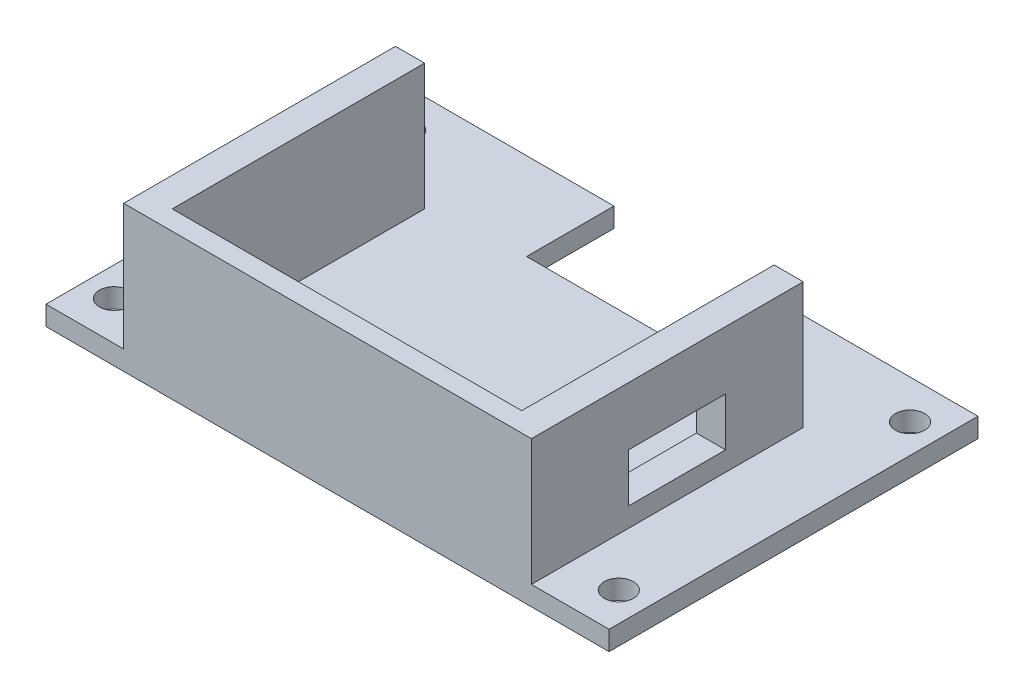
from build123d import *

# Parameters (mm, degrees)
SKETCH1_W               = 58
SKETCH1_H               = 38
BOSS_EXTRUDE1_DEPTH     = 1
CUT_EXTRUDE1_DEPTH      = 35.684290392
CUT_EXTRUDE1_DEPTH_BACK = 35.684290392
SKETCH2_W               = 17
SKETCH2_H               = 14.502040096
SKETCH3_W               = 3
SKETCH3_H               = 27
BOSS_EXTRUDE2_DEPTH     = 13
SKETCH4_W               = 42
SKETCH4_H               = 2
BOSS_EXTRUDE3_DEPTH     = 13
CUT_EXTRUDE2_START      = -42
SKETCH5_W               = 10
SKETCH5_H               = 5
CUT_EXTRUDE2_DEPTH      = 3
CUT_EXTRUDE3_REACH      = 39.027
SKETCH6_R               = 1.5


with BuildPart() as part:
    # Sketch1 → Boss-Extrude1 (new, symmetric)
    with BuildSketch(Plane(origin=(0, 0, 0), x_dir=(1, 0, 0), z_dir=(0, 1, 0))):
        Rectangle(SKETCH1_W, SKETCH1_H)
    extrude(amount=BOSS_EXTRUDE1_DEPTH, both=True)

    # Sketch2 → Cut-Extrude1 (cut, two sides: drawn at the far end of the back side and taken through both)
    with BuildSketch(Plane(origin=(0, 0, 0), x_dir=(1, 0, 0), z_dir=(0, 1, 0)).offset(-CUT_EXTRUDE1_DEPTH_BACK)):
        with Locations((0, 17.251020048)):
            Rectangle(SKETCH2_W, SKETCH2_H)
    extrude(amount=CUT_EXTRUDE1_DEPTH + CUT_EXTRUDE1_DEPTH_BACK, mode=Mode.SUBTRACT)

    # Sketch3 → Boss-Extrude2 (add)
    with BuildSketch(Plane(origin=(0, 1, 0), x_dir=(1, 0, 0), z_dir=(0, 1, 0))):
        with Locations((19.5, -4.5)):
            Rectangle(SKETCH3_W, SKETCH3_H)
        with Locations((-19.5, -4.5)):
            Rectangle(SKETCH3_W, SKETCH3_H)
    extrude(amount=BOSS_EXTRUDE2_DEPTH)

    # Sketch4 → Boss-Extrude3 (add)
    with BuildSketch(Plane(origin=(0, 1, 0), x_dir=(1, 0, 0), z_dir=(0, 1, 0))):
        with Locations((0, -18)):
            Rectangle(SKETCH4_W, SKETCH4_H)
    extrude(amount=BOSS_EXTRUDE3_DEPTH)

    # Sketch5 → Cut-Extrude2 (cut)
    with BuildSketch(Plane.ZY.offset(21).offset(CUT_EXTRUDE2_START)):
        with Locations((4, 5.5)):
            Rectangle(SKETCH5_W, SKETCH5_H)
    extrude(amount=CUT_EXTRUDE2_DEPTH, mode=Mode.SUBTRACT)

    # Sketch6 → Cut-Extrude3 (cut, up to next)
    with BuildSketch(Plane(origin=(0, 1, 0), x_dir=(1, 0, 0), z_dir=(0, 1, 0)), mode=Mode.PRIVATE) as cut_extrude3_sk1:
        with Locations(Location((-26, 15, 0), (0, 0, 270))):
            Circle(SKETCH6_R)
    cut_extrude3_tool1 = extrude(cut_extrude3_sk1.sketch, amount=-CUT_EXTRUDE3_REACH, mode=Mode.PRIVATE) & part.part
    # Sketch6 → Cut-Extrude3 (cut, up to next)
    with BuildSketch(Plane(origin=(0, 1, 0), x_dir=(1, 0, 0), z_dir=(0, 1, 0)), mode=Mode.PRIVATE) as cut_extrude3_sk2:
        with Locations(Location((-26, -15, 0), (0, 0, 90))):
            Circle(SKETCH6_R)
    cut_extrude3_tool2 = extrude(cut_extrude3_sk2.sketch, amount=-CUT_EXTRUDE3_REACH, mode=Mode.PRIVATE) & part.part
    # Sketch6 → Cut-Extrude3 (cut, up to next)
    with BuildSketch(Plane(origin=(0, 1, 0), x_dir=(1, 0, 0), z_dir=(0, 1, 0)), mode=Mode.PRIVATE) as cut_extrude3_sk3:
        with Locations(Location((26, -15, 0), (0, 0, 270))):
            Circle(SKETCH6_R)
    cut_extrude3_tool3 = extrude(cut_extrude3_sk3.sketch, amount=-CUT_EXTRUDE3_REACH, mode=Mode.PRIVATE) & part.part
    # Sketch6 → Cut-Extrude3 (cut, up to next)
    with BuildSketch(Plane(origin=(0, 1, 0), x_dir=(1, 0, 0), z_dir=(0, 1, 0)), mode=Mode.PRIVATE) as cut_extrude3_sk4:
        with Locations(Location((26, 15, 0), (0, 0, 90))):
            Circle(SKETCH6_R)
    cut_extrude3_tool4 = extrude(cut_extrude3_sk4.sketch, amount=-CUT_EXTRUDE3_REACH, mode=Mode.PRIVATE) & part.part
    add(cut_extrude3_tool1.solids().sort_by_distance((-26, 1, -15))[0], mode=Mode.SUBTRACT)
    add(cut_extrude3_tool2.solids().sort_by_distance((-26, 1, 15))[0], mode=Mode.SUBTRACT)
    add(cut_extrude3_tool3.solids().sort_by_distance((26, 1, 15))[0], mode=Mode.SUBTRACT)
    add(cut_extrude3_tool4.solids().sort_by_distance((26, 1, -15))[0], mode=Mode.SUBTRACT)


solid = part.part
